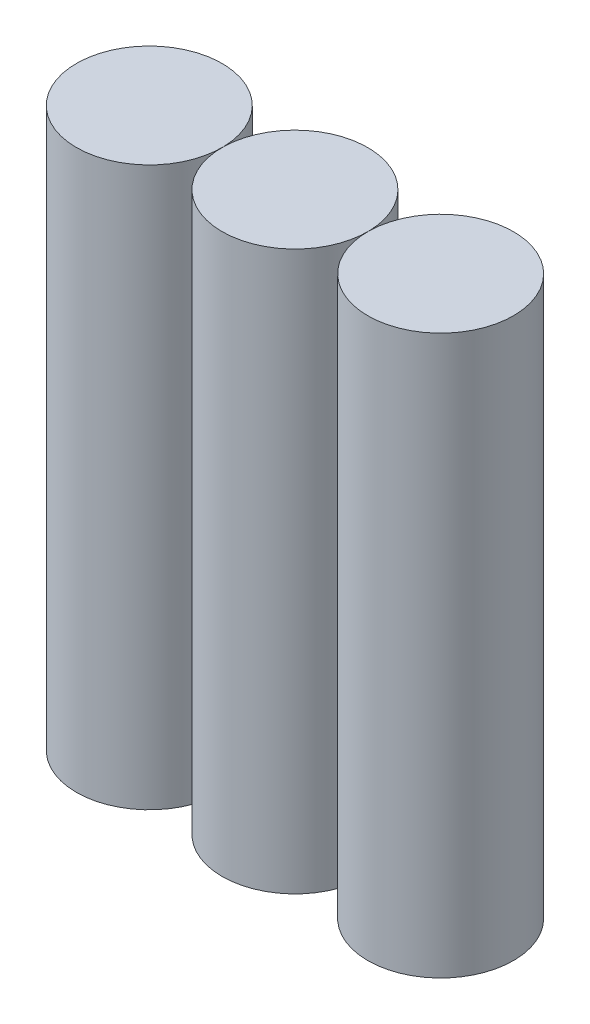
from build123d import *

# Parameters (mm, degrees)
SKETCH1_R             = 9
BOSS_EXTRUDE1_DEPTH   = 34.5
BOSS_EXTRUDE1_2_DEPTH = 34.5
BOSS_EXTRUDE1_3_DEPTH = 34.5


with BuildPart() as part:
    # Sketch1 → Boss-Extrude1 (new, symmetric)
    with BuildSketch(Plane(origin=(0, 0, 0), x_dir=(1, 0, 0), z_dir=(0, 1, 0))):
        with Locations(Location((-18, 0, 0), (0, 0, 270))):
            Circle(SKETCH1_R)
    extrude(amount=BOSS_EXTRUDE1_DEPTH, both=True)


with BuildPart() as body_2:
    # Sketch1 → Boss-Extrude1 2 (new, symmetric)
    with BuildSketch(Plane(origin=(0, 0, 0), x_dir=(1, 0, 0), z_dir=(0, 1, 0))):
        with Locations(Location((0, 0, 0), (0, 0, 270))):
            Circle(SKETCH1_R)
    extrude(amount=BOSS_EXTRUDE1_2_DEPTH, both=True)


with BuildPart() as body_3:
    # Sketch1 → Boss-Extrude1 3 (new, symmetric)
    with BuildSketch(Plane(origin=(0, 0, 0), x_dir=(1, 0, 0), z_dir=(0, 1, 0))):
        with Locations(Location((18, 0, 0), (0, 0, 270))):
            Circle(SKETCH1_R)
    extrude(amount=BOSS_EXTRUDE1_3_DEPTH, both=True)


solid = Compound([part.part, body_2.part, body_3.part])
